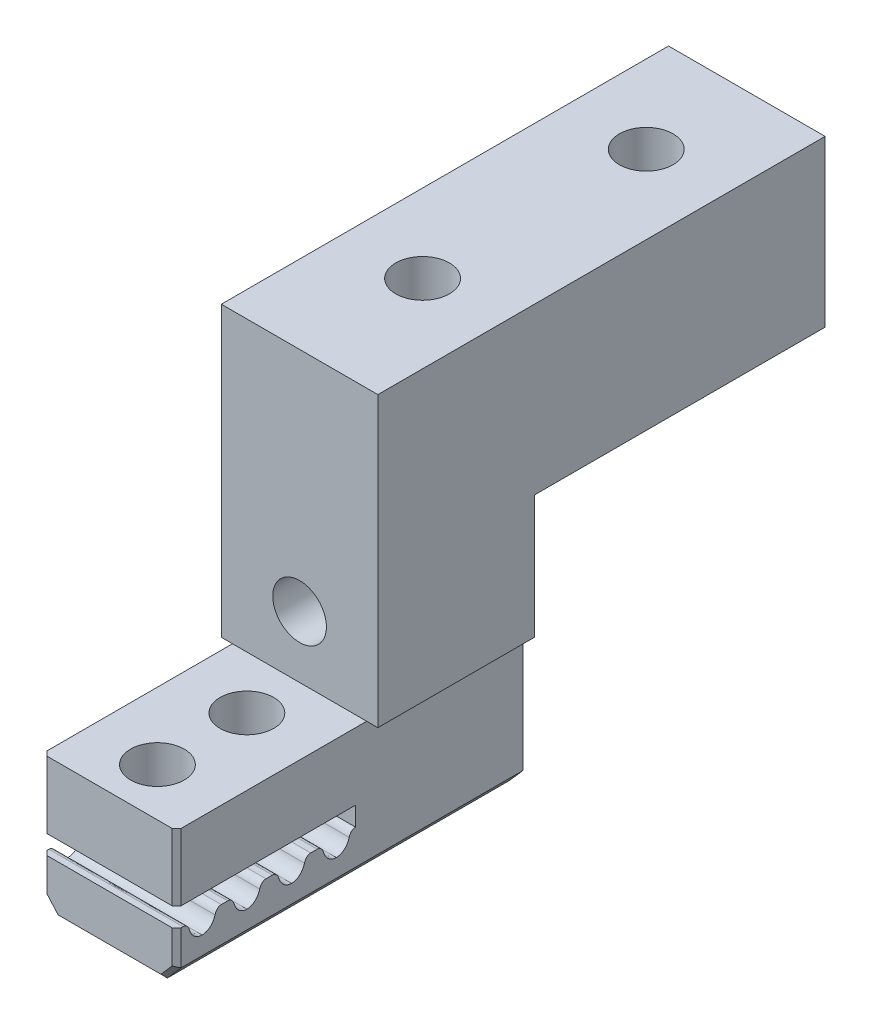
from build123d import *

# Parameters (mm, degrees)
BOSS_EXTRUDE1_DEPTH     = 13
SKETCH6_W               = 6
SKETCH6_H               = 5
BOSS_EXTRUDE4_DEPTH     = 5.6
SKETCH16_W              = 6
SKETCH16_H              = 8
BOSS_EXTRUDE5_DEPTH     = 0.1
CUT_EXTRUDE6_DEPTH      = 4
CUT_EXTRUDE6_DEPTH_BACK = 3.6
SKETCH15_R              = 1.2
CUT_EXTRUDE7_DEPTH      = 8.7202
CUT_EXTRUDE8_START      = -0.2202
SKETCH19_W              = 6
SKETCH19_H              = 8
SKETCH19_R              = 1.2
CUT_EXTRUDE8_DEPTH      = 0.2202
SKETCH12_R              = 1.2
CUT_EXTRUDE5_DEPTH      = 6
CHAMFER1_SIZE           = 0.2
SKETCH21_R              = 1.2
BOSS_EXTRUDE6_DEPTH     = 2.5
SKETCH24_W              = 6
SKETCH24_H              = 5.5
CUT_EXTRUDE10_DEPTH     = 8.5
SKETCH25_W              = 6
SKETCH25_H              = 7
BOSS_EXTRUDE8_DEPTH     = 12.9
SKETCH26_W              = 6
SKETCH26_H              = 7.39
BOSS_EXTRUDE9_DEPTH     = 5
SKETCH27_W              = 6
SKETCH27_H              = 7.39
BOSS_EXTRUDE10_DEPTH    = 8
SKETCH28_R              = 1.2
CUT_EXTRUDE11_DEPTH     = 7.5
SKETCH30_R              = 1.2
CUT_EXTRUDE13_DEPTH     = 8
SKETCH31_W              = 7
SKETCH31_H              = 12.9
BOSS_EXTRUDE11_DEPTH    = 0.5
SKETCH32_W              = 7
SKETCH32_H              = 12.9
BOSS_EXTRUDE12_DEPTH    = 0.5
SKETCH33_W              = 0.5
SKETCH33_H              = 7.39
BOSS_EXTRUDE13_DEPTH    = 13
SKETCH34_R              = 1.2
CUT_EXTRUDE14_DEPTH     = 5


with BuildPart() as part:
    # Sketch1 → Boss-Extrude1 (new body)
    with BuildSketch(Plane.XY):
        Polygon((3, 3.05), (3, -2.253801214), (2.388188946, -2.95), (-2.388188946, -2.95), (-3, -2.253801214), (-3, 3.05), align=None)
    extrude(amount=BOSS_EXTRUDE1_DEPTH)

    # Sketch6 → Boss-Extrude4 (add)
    with BuildSketch(Plane(origin=(0, 3.05, 0), x_dir=(1, 0, 0), z_dir=(0, 1, 0))):
        with Locations((0, -2.5)):
            Rectangle(SKETCH6_W, SKETCH6_H)
    extrude(amount=BOSS_EXTRUDE4_DEPTH)

    # Sketch16 → Boss-Extrude5 (add)
    with BuildSketch(Plane(origin=(0, 3.05, 0), x_dir=(1, 0, 0), z_dir=(0, 1, 0))):
        with Locations((0, -9)):
            Rectangle(SKETCH16_W, SKETCH16_H)
    extrude(amount=BOSS_EXTRUDE5_DEPTH)

    # Sketch18 → Cut-Extrude6 (cut, two sides: drawn at the far end of the back side and taken through both)
    with BuildSketch(Plane(origin=(0, 0, 0), x_dir=(0, 0, -1), z_dir=(1, 0, 0)).offset(-CUT_EXTRUDE6_DEPTH_BACK)):
        with BuildLine():
            Line((-8.8572, -0.0702), (-12.8572, -0.0702))
            Line((-12.8572, -0.0702), (-13, -0.0702))
            Line((-13, -0.0702), (-13, -0.7))
            Line((-13, -0.7), (-12.8572, -0.7))
            Line((-12.8572, -0.7), (-12.7144, -0.7))
            add(Edge.make_bspline(
                [(-12.7144, -0.7), (-12.5198, -0.7), (-12.43, -0.9509)],
                knots=[0.103448276, 0.103448276, 0.103448276, 0.137931034, 0.137931034, 0.137931034], degree=2))
            add(Edge.make_bspline(
                [(-12.43, -0.9509), (-12.3594, -1.2388), (-12.13, -1.45), (-11.8572, -1.45)],
                knots=[0.137931034, 0.137931034, 0.137931034, 0.137931034, 0.172413793, 0.172413793, 0.172413793, 0.172413793], degree=3))
            add(Edge.make_bspline(
                [(-11.8572, -1.45), (-11.5844, -1.45), (-11.355, -1.2388), (-11.2844, -0.9509)],
                knots=[0.172413793, 0.172413793, 0.172413793, 0.172413793, 0.206896552, 0.206896552, 0.206896552, 0.206896552], degree=3))
            add(Edge.make_bspline(
                [(-11.2844, -0.9509), (-11.1946, -0.7), (-11, -0.7)],
                knots=[0.206896552, 0.206896552, 0.206896552, 0.24137931, 0.24137931, 0.24137931], degree=2))
            Line((-11, -0.7), (-10.8572, -0.7))
            Line((-10.8572, -0.7), (-10.7144, -0.7))
            add(Edge.make_bspline(
                [(-10.7144, -0.7), (-10.5198, -0.7), (-10.43, -0.9509)],
                knots=[0.310344828, 0.310344828, 0.310344828, 0.344827586, 0.344827586, 0.344827586], degree=2))
            add(Edge.make_bspline(
                [(-10.43, -0.9509), (-10.3594, -1.2388), (-10.13, -1.45), (-9.8572, -1.45)],
                knots=[0.344827586, 0.344827586, 0.344827586, 0.344827586, 0.379310345, 0.379310345, 0.379310345, 0.379310345], degree=3))
            add(Edge.make_bspline(
                [(-9.8572, -1.45), (-9.5844, -1.45), (-9.355, -1.2388), (-9.2844, -0.9509)],
                knots=[0.379310345, 0.379310345, 0.379310345, 0.379310345, 0.413793103, 0.413793103, 0.413793103, 0.413793103], degree=3))
            add(Edge.make_bspline(
                [(-9.2844, -0.9509), (-9.1946, -0.7), (-9, -0.7)],
                knots=[0.413793103, 0.413793103, 0.413793103, 0.448275862, 0.448275862, 0.448275862], degree=2))
            Line((-9, -0.7), (-8.8572, -0.7))
            Line((-8.8572, -0.7), (-8.7144, -0.7))
            add(Edge.make_bspline(
                [(-8.7144, -0.7), (-8.5198, -0.7), (-8.43, -0.9509)],
                knots=[0.517241379, 0.517241379, 0.517241379, 0.551724138, 0.551724138, 0.551724138], degree=2))
            add(Edge.make_bspline(
                [(-8.43, -0.9509), (-8.3594, -1.2388), (-8.13, -1.45), (-7.8572, -1.45)],
                knots=[0.551724138, 0.551724138, 0.551724138, 0.551724138, 0.586206897, 0.586206897, 0.586206897, 0.586206897], degree=3))
            add(Edge.make_bspline(
                [(-7.8572, -1.45), (-7.5844, -1.45), (-7.355, -1.2388), (-7.2844, -0.9509)],
                knots=[0.586206897, 0.586206897, 0.586206897, 0.586206897, 0.620689655, 0.620689655, 0.620689655, 0.620689655], degree=3))
            add(Edge.make_bspline(
                [(-7.2844, -0.9509), (-7.1946, -0.7), (-7, -0.7)],
                knots=[0.620689655, 0.620689655, 0.620689655, 0.655172414, 0.655172414, 0.655172414], degree=2))
            Line((-7, -0.7), (-6.8572, -0.7))
            Line((-6.8572, -0.7), (-6.7144, -0.7))
            add(Edge.make_bspline(
                [(-6.7144, -0.7), (-6.5198, -0.7), (-6.43, -0.9509)],
                knots=[0.724137931, 0.724137931, 0.724137931, 0.75862069, 0.75862069, 0.75862069], degree=2))
            add(Edge.make_bspline(
                [(-6.43, -0.9509), (-6.3594, -1.2388), (-6.13, -1.45), (-5.8572, -1.45)],
                knots=[0.75862069, 0.75862069, 0.75862069, 0.75862069, 0.793103448, 0.793103448, 0.793103448, 0.793103448], degree=3))
            add(Edge.make_bspline(
                [(-5.8572, -1.45), (-5.5844, -1.45), (-5.355, -1.2388), (-5.2844, -0.9509)],
                knots=[0.793103448, 0.793103448, 0.793103448, 0.793103448, 0.827586207, 0.827586207, 0.827586207, 0.827586207], degree=3))
            add(Edge.make_bspline(
                [(-5.2844, -0.9509), (-5.1946, -0.7), (-5, -0.7)],
                knots=[0.827586207, 0.827586207, 0.827586207, 0.862068966, 0.862068966, 0.862068966], degree=2))
            Line((-5, -0.7), (-5, -0.0702))
            Line((-5, -0.0702), (-8.8572, -0.0702))
        make_face()
    extrude(amount=CUT_EXTRUDE6_DEPTH + CUT_EXTRUDE6_DEPTH_BACK, mode=Mode.SUBTRACT)

    # Sketch15 → Cut-Extrude7 (cut)
    with BuildSketch(Plane(origin=(0, 8.65, 0), x_dir=(1, 0, 0), z_dir=(0, 1, 0))):
        with Locations(Location((0, -10.8572, 0), (0, 0, 180))):
            Circle(SKETCH15_R)
        with Locations(Location((0, -6.8572, 0), (0, 0, 180))):
            Circle(SKETCH15_R)
    extrude(amount=-CUT_EXTRUDE7_DEPTH, mode=Mode.SUBTRACT)

    # Sketch19 → Cut-Extrude8 (cut)
    with BuildSketch(Plane.XZ.offset(0.0702).offset(CUT_EXTRUDE8_START)):
        with Locations((0, 9)):
            Rectangle(SKETCH19_W, SKETCH19_H)
        with Locations(Location((0, 10.8572, 0), (0, 0, 180))):
            Circle(SKETCH19_R, mode=Mode.SUBTRACT)
        with Locations(Location((0, 6.8572, 0), (0, 0, 180))):
            Circle(SKETCH19_R, mode=Mode.SUBTRACT)
    extrude(amount=CUT_EXTRUDE8_DEPTH, mode=Mode.SUBTRACT)

    # Sketch12 → Cut-Extrude5 (cut)
    with BuildSketch(Plane.XY.offset(5)):
        with Locations((0, 5.85)):
            Circle(SKETCH12_R)
    extrude(amount=-CUT_EXTRUDE5_DEPTH, mode=Mode.SUBTRACT)

    # Chamfer1
    chamfer1_edges = [part.edges().sort_by_distance(p)[0] for p in [
        (-2.694094473, -2.601900607, 13),
        (0, -2.95, 13),
        (2.694094473, -2.601900607, 13),
        (3, 1.65, 13),
        (3, -1.476900607, 13),
        (-3, -1.476900607, 13),
        (-3, 1.65, 13),
    ]]
    chamfer(chamfer1_edges, length=CHAMFER1_SIZE)

    # Sketch21 → Boss-Extrude6 (add)
    with BuildSketch(Plane(origin=(0, 0, 0), x_dir=(-1, 0, 0), z_dir=(0, 0, -1))):
        Polygon((-2.388188946, -2.95), (2.388188946, -2.95), (3, -2.253801214), (3, 8.65), (-3, 8.65), (-3, -2.253801214), align=None)
        with Locations(Location((0, 5.85, 0), (0, 0, 180))):
            Circle(SKETCH21_R, mode=Mode.SUBTRACT)
    extrude(amount=BOSS_EXTRUDE6_DEPTH)

    # Sketch24 → Cut-Extrude10 (cut)
    with BuildSketch(Plane.XY.offset(5)):
        with Locations((0, 5.9)):
            Rectangle(SKETCH24_W, SKETCH24_H)
    extrude(amount=-CUT_EXTRUDE10_DEPTH, mode=Mode.SUBTRACT)

    # Sketch25 → Boss-Extrude8 (add)
    with BuildSketch(Plane(origin=(0, 3.15, 0), x_dir=(1, 0, 0), z_dir=(0, 1, 0))):
        with Locations((0, -1)):
            Rectangle(SKETCH25_W, SKETCH25_H)
    extrude(amount=BOSS_EXTRUDE8_DEPTH)

    # Sketch26 → Boss-Extrude9 (add)
    with BuildSketch(Plane(origin=(0, 0, -2.5), x_dir=(-1, 0, 0), z_dir=(0, 0, -1))):
        with Locations((0, 12.355)):
            Rectangle(SKETCH26_W, SKETCH26_H)
    extrude(amount=BOSS_EXTRUDE9_DEPTH)

    # Sketch27 → Boss-Extrude10 (add)
    with BuildSketch(Plane(origin=(0, 0, -7.5), x_dir=(-1, 0, 0), z_dir=(0, 0, -1))):
        with Locations((0, 12.355)):
            Rectangle(SKETCH27_W, SKETCH27_H)
    extrude(amount=BOSS_EXTRUDE10_DEPTH)

    # Sketch28 → Cut-Extrude11 (cut)
    with BuildSketch(Plane(origin=(0, 16.05, 0), x_dir=(1, 0, 0), z_dir=(0, 1, 0))):
        with Locations(Location((0, 11, 0), (0, 0, 180))):
            Circle(SKETCH28_R)
    extrude(amount=-CUT_EXTRUDE11_DEPTH, mode=Mode.SUBTRACT)

    # Sketch30 → Cut-Extrude13 (cut)
    with BuildSketch(Plane(origin=(0, 0, -2.5), x_dir=(-1, 0, 0), z_dir=(0, 0, -1))):
        with Locations((0, 5.9)):
            Circle(SKETCH30_R)
    extrude(amount=-CUT_EXTRUDE13_DEPTH, mode=Mode.SUBTRACT)

    # Sketch31 → Boss-Extrude11 (add)
    with BuildSketch(Plane(origin=(3, 0, 0), x_dir=(0, 0, -1), z_dir=(1, 0, 0))):
        with Locations((-1, 9.6)):
            Rectangle(SKETCH31_W, SKETCH31_H)
    extrude(amount=BOSS_EXTRUDE11_DEPTH)

    # Sketch32 → Boss-Extrude12 (add)
    with BuildSketch(Plane.ZY.offset(3)):
        with Locations((1, 9.6)):
            Rectangle(SKETCH32_W, SKETCH32_H)
    extrude(amount=BOSS_EXTRUDE12_DEPTH)

    # Sketch33 → Boss-Extrude13 (add)
    with BuildSketch(Plane(origin=(0, 0, -2.5), x_dir=(-1, 0, 0), z_dir=(0, 0, -1))):
        with Locations((-3.25, 12.355)):
            Rectangle(SKETCH33_W, SKETCH33_H)
        with Locations((3.25, 12.355)):
            Rectangle(SKETCH33_W, SKETCH33_H)
    extrude(amount=BOSS_EXTRUDE13_DEPTH)

    # Sketch34 → Cut-Extrude14 (cut)
    with BuildSketch(Plane(origin=(0, 16.05, 0), x_dir=(1, 0, 0), z_dir=(0, 1, 0))):
        with Locations(Location((0, 1, 0), (0, 0, 180))):
            Circle(SKETCH34_R)
    extrude(amount=-CUT_EXTRUDE14_DEPTH, mode=Mode.SUBTRACT)


solid = part.part
